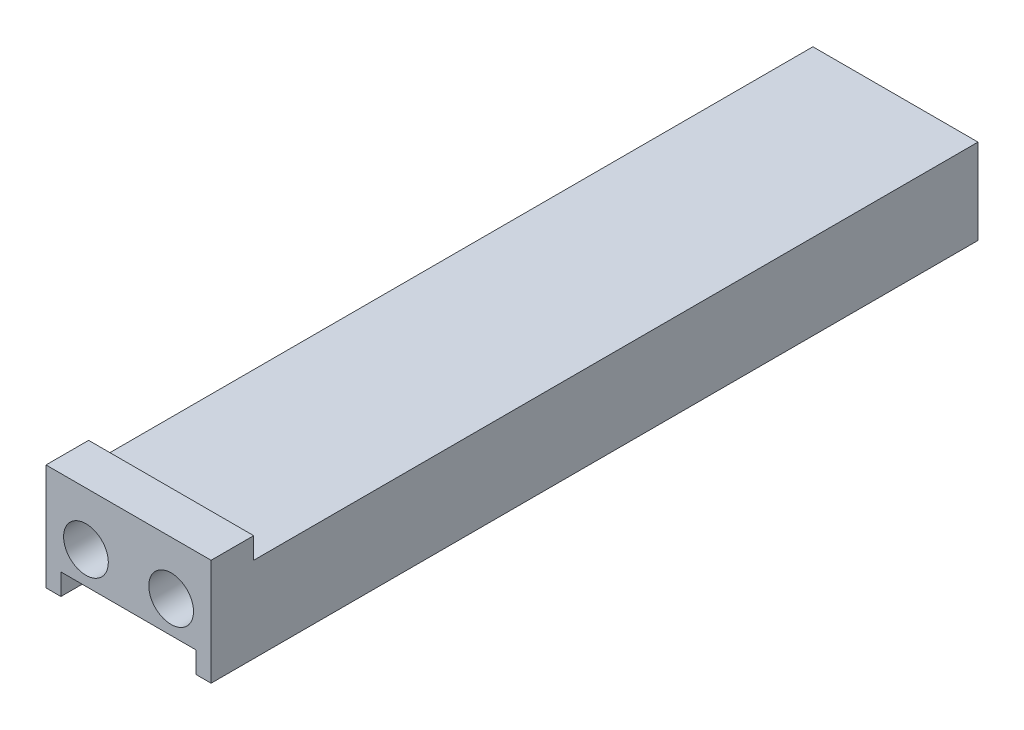
from build123d import *

# Parameters (mm, degrees)
SKETCH_1_W          = 15.5
SKETCH_1_H          = 8
EXTRUDE_1_DEPTH     = 72
SKETCH_2_W          = 12.7
SKETCH_2_H          = 2
CUT_EXTRUDE_1_DEPTH = 75.082724032
SKETCH_3_W          = 15.5
SKETCH_3_H          = 4
EXTRUDE_2_DEPTH     = 2
SKETCH_5_R          = 2.1
CUT_EXTRUDE_3_DEPTH = 10


with BuildPart() as part:
    # 草图1 → 凸台-拉伸1 (new body)
    with BuildSketch(Plane.XY):
        with Locations((7.75, 4)):
            Rectangle(SKETCH_1_W, SKETCH_1_H)
    extrude(amount=EXTRUDE_1_DEPTH)

    # 草图2 → 切除-拉伸1 (cut, through all)
    with BuildSketch(Plane(origin=(0, 0, 0), x_dir=(-1, 0, 0), z_dir=(0, 0, -1))):
        with Locations((-7.75, 1)):
            Rectangle(SKETCH_2_W, SKETCH_2_H)
    extrude(amount=-CUT_EXTRUDE_1_DEPTH, mode=Mode.SUBTRACT)

    # 草图3 → 凸台-拉伸2 (add)
    with BuildSketch(Plane(origin=(0, 8, 0), x_dir=(1, 0, 0), z_dir=(0, 1, 0))):
        with Locations((7.75, -70)):
            Rectangle(SKETCH_3_W, SKETCH_3_H)
    extrude(amount=EXTRUDE_2_DEPTH)

    # 草图5 → 切除-拉伸3 (cut)
    with BuildSketch(Plane.XY.offset(72)):
        with Locations((3.75, 5)):
            Circle(SKETCH_5_R)
        with Locations(Location((11.75, 5, 0), (0, 0, 180))):
            Circle(SKETCH_5_R)
    extrude(amount=-CUT_EXTRUDE_3_DEPTH, mode=Mode.SUBTRACT)


solid = part.part
